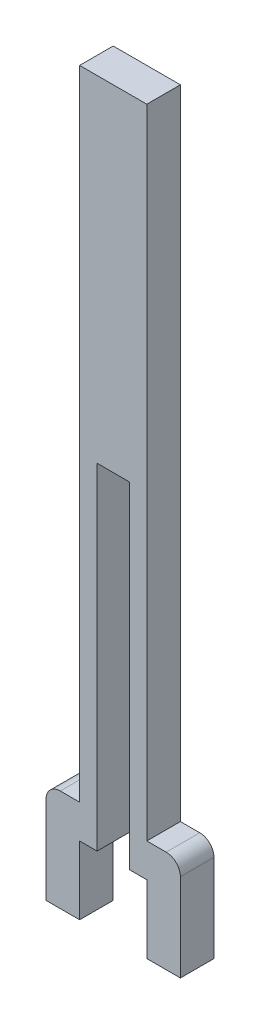
from build123d import *

# Parameters (mm, degrees)
EXTRUDE_1_DEPTH     = 3
FILLET_1_R          = 1.27
SKETCH_2_W          = 2.88
SKETCH_2_H          = 29.994
CUT_EXTRUDE_1_DEPTH = 3


with BuildPart() as part:
    # 스케치1 → 보스-돌출1 (new body)
    with BuildSketch(Plane.XY):
        Polygon((-3, 33.044), (3, 33.044), (3, -23.944), (6, -23.944), (6, -33.044), (3, -33.044), (3, -26.944), (-3, -26.944), (-3, -33.044), (-6, -33.044), (-6, -23.944), (-3, -23.944), align=None)
    extrude(amount=EXTRUDE_1_DEPTH)

    # 필렛1
    fillet_1_edges = [part.edges().sort_by_distance(p)[0] for p in [
        (6, -23.944, 1.5),
        (-6, -23.944, 1.5),
    ]]
    fillet(fillet_1_edges, radius=FILLET_1_R)

    # 스케치2 → 컷-돌출1 (cut)
    with BuildSketch(Plane(origin=(0, 0, 0), x_dir=(-1, 0, 0), z_dir=(0, 0, -1))):
        with Locations((0, -11.947)):
            Rectangle(SKETCH_2_W, SKETCH_2_H)
    extrude(amount=-CUT_EXTRUDE_1_DEPTH, mode=Mode.SUBTRACT)


solid = part.part
